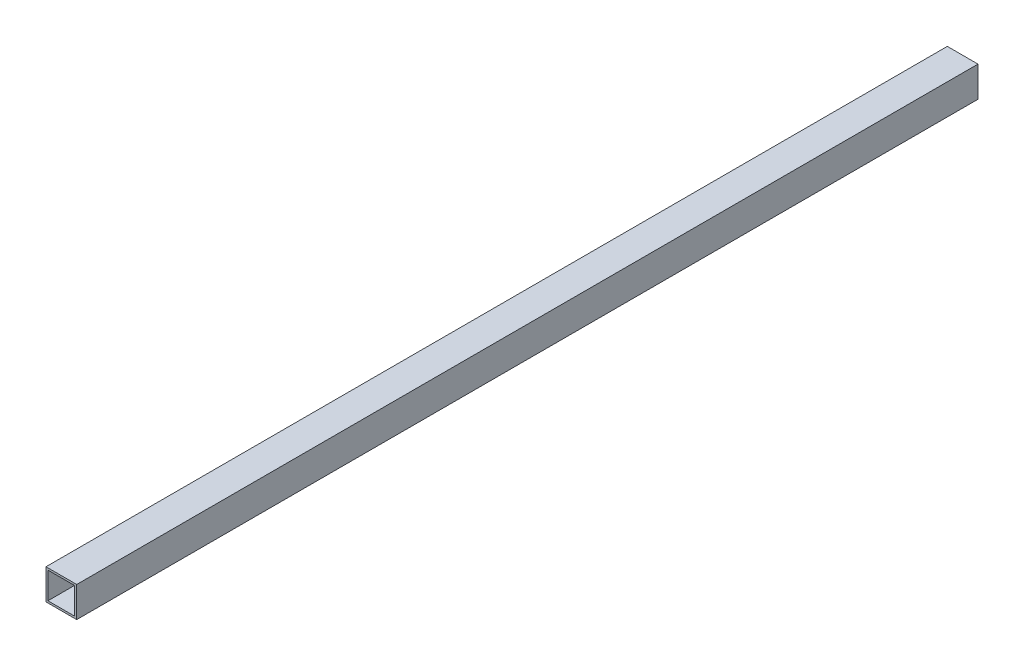
from build123d import *

# Parameters (mm, degrees)
CROQUIS1_W              = 63
CROQUIS1_H              = 62.5
CROQUIS1_W_2            = 55
CROQUIS1_H_2            = 54.5
SALIENTE_EXTRUIR1_DEPTH = 1850


with BuildPart() as part:
    # Croquis1 → Saliente-Extruir1 (new body)
    with BuildSketch(Plane.XY):
        with Locations((-38.134513149, -8.980944351)):
            Rectangle(CROQUIS1_W, CROQUIS1_H)
        with Locations((-38.134513149, -8.980944351)):
            Rectangle(CROQUIS1_W_2, CROQUIS1_H_2, mode=Mode.SUBTRACT)
    extrude(amount=SALIENTE_EXTRUIR1_DEPTH)


solid = part.part
